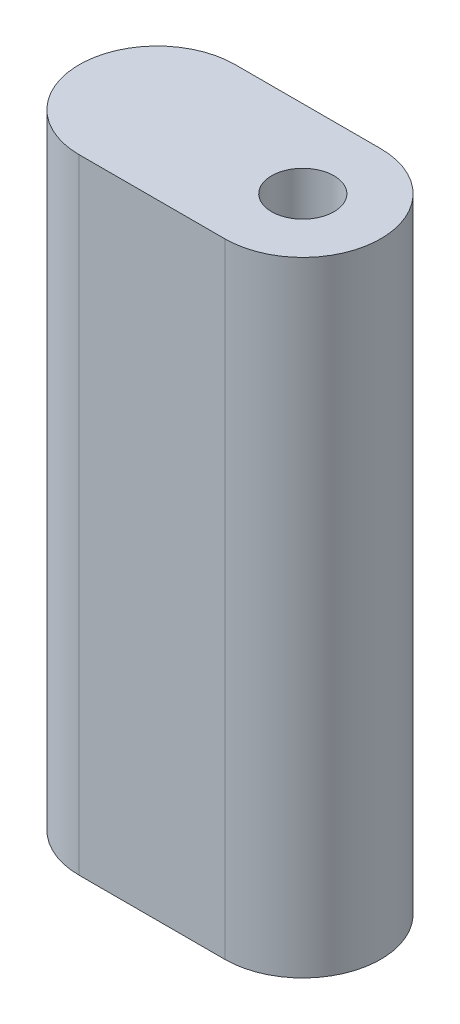
from build123d import *

# Parameters (mm, degrees)
BOSS_EXTRUDE2_DEPTH = 30
SKETCH2_R           = 1.5
CUT_EXTRUDE1_DEPTH  = 30
SKETCH3_R           = 1.5
CUT_EXTRUDE2_DEPTH  = 10


with BuildPart() as part:
    # Sketch1 → Boss-Extrude2 (new body)
    with BuildSketch(Plane(origin=(0, 0, 0), x_dir=(1, 0, 0), z_dir=(0, 1, 0))):
        with BuildLine():
            ThreePointArc((0, 3.75), (-3.75, 0), (0, -3.75))
            Line((0, -3.75), (7, -3.75))
            ThreePointArc((7, -3.75), (10.75, 0), (7, 3.75))
            Line((7, 3.75), (0, 3.75))
        make_face()
    extrude(amount=BOSS_EXTRUDE2_DEPTH)

    # Sketch2 → Cut-Extrude1 (cut)
    with BuildSketch(Plane(origin=(0, 30, 0), x_dir=(1, 0, 0), z_dir=(0, 1, 0))):
        with Locations((7, 0)):
            Circle(SKETCH2_R)
    extrude(amount=-CUT_EXTRUDE1_DEPTH, mode=Mode.SUBTRACT)

    # Sketch3 → Cut-Extrude2 (cut)
    with BuildSketch(Plane.XZ):
        Circle(SKETCH3_R)
    extrude(amount=-CUT_EXTRUDE2_DEPTH, mode=Mode.SUBTRACT)


solid = part.part
